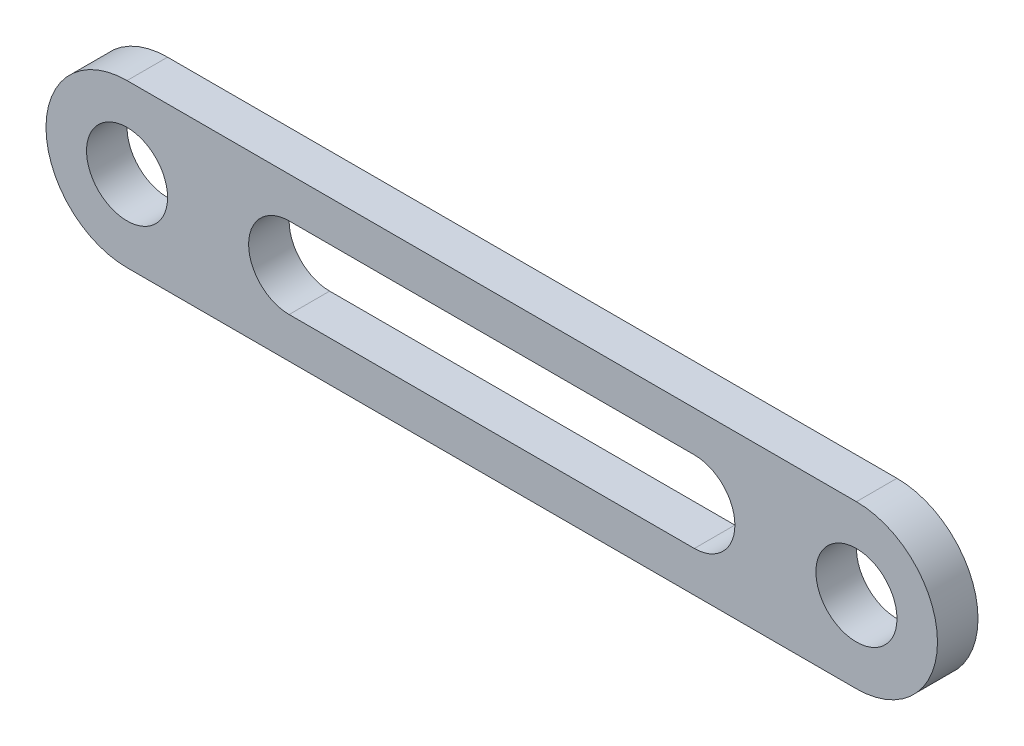
from build123d import *

# Parameters (mm, degrees)
ESBO_O1_R                = 5
RESSALTO_EXTRUS_O1_DEPTH = 5


with BuildPart() as part:
    # Esboço1 → Ressalto-extrusão1 (new body)
    with BuildSketch(Plane.XY):
        with BuildLine():
            Line((-90, 10), (0, 10))
            ThreePointArc((0, 10), (10, 0), (0, -10))
            Line((0, -10), (-90, -10))
            ThreePointArc((-90, -10), (-100, 0), (-90, 10))
        make_face()
        Circle(ESBO_O1_R, mode=Mode.SUBTRACT)
        with Locations((-90, 0)):
            Circle(ESBO_O1_R, mode=Mode.SUBTRACT)
        with BuildLine():
            ThreePointArc((-20, -5), (-15, 0), (-20, 5))
            Line((-20, 5), (-70, 5))
            ThreePointArc((-70, 5), (-75, 0), (-70, -5))
            Line((-70, -5), (-20, -5))
        make_face(mode=Mode.SUBTRACT)
    extrude(amount=RESSALTO_EXTRUS_O1_DEPTH)


solid = part.part
